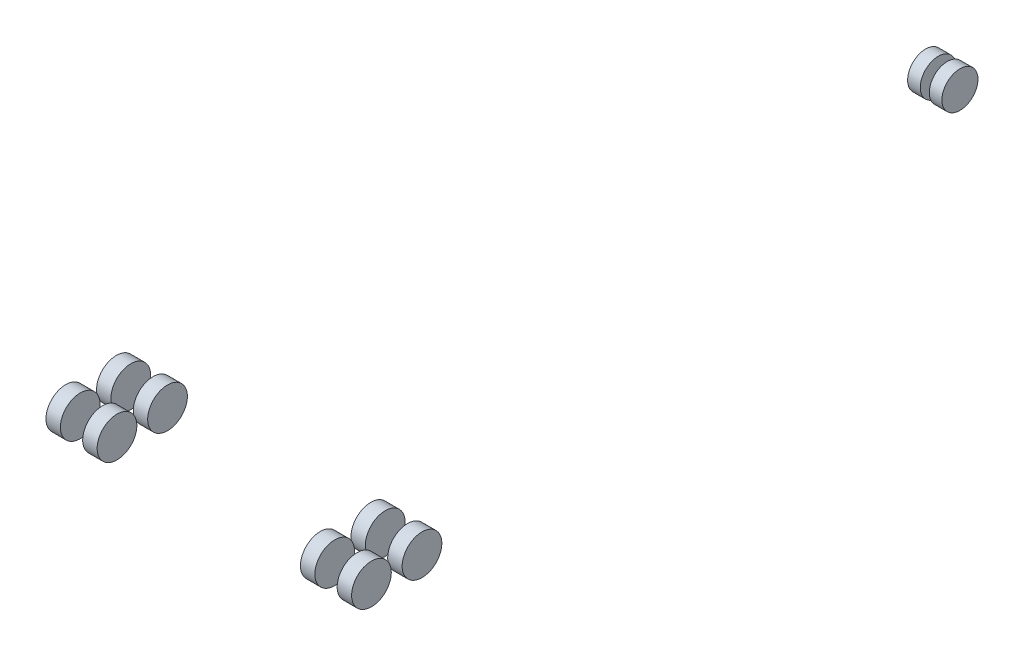
from build123d import *

# Parameters (mm, degrees)
MAIN_TIRE_1_DEPTH        = 203.2
MAIN_TIRE_1_DEPTH_BACK   = 203.2
SKETCH9_R                = 558.8
MAIN_TIRE_1_2_DEPTH      = 203.2
MAIN_TIRE_1_2_DEPTH_BACK = 203.2
MAIN_TIRE_2_DEPTH        = 203.2
MAIN_TIRE_2_DEPTH_BACK   = 203.2
SKETCH10_R               = 558.8
MAIN_TIRE_2_2_DEPTH      = 203.2
MAIN_TIRE_2_2_DEPTH_BACK = 203.2
MAIN_TIRE_3_DEPTH        = 203.2
MAIN_TIRE_3_DEPTH_BACK   = 203.2
SKETCH12_R               = 558.8
MAIN_TIRE_3_2_DEPTH      = 203.2
MAIN_TIRE_3_2_DEPTH_BACK = 203.2
MAIN_TIRE_4_DEPTH        = 203.2
MAIN_TIRE_4_DEPTH_BACK   = 203.2
SKETCH13_R               = 558.8
MAIN_TIRE_4_2_DEPTH      = 203.2
MAIN_TIRE_4_2_DEPTH_BACK = 203.2
NOSE_TIRE_1_DEPTH        = 177.8
NOSE_TIRE_1_DEPTH_BACK   = 177.8
SKETCH14_R               = 508
NOSE_TIRE_2_DEPTH        = 177.8
NOSE_TIRE_2_DEPTH_BACK   = 177.8
SKETCH15_R               = 508


with BuildPart() as part:
    # Sketch9 → Main tire 1 (new, two sides: drawn at the far end of the back side and taken through both)
    with BuildSketch(Plane(origin=(-3063.888900242, 0, 0), x_dir=(0, 0, -1), z_dir=(1, 0, 0)).offset(-MAIN_TIRE_1_DEPTH_BACK)):
        with Locations((-2701.028038879, 558.8)):
            Circle(SKETCH9_R)
    extrude(amount=MAIN_TIRE_1_DEPTH + MAIN_TIRE_1_DEPTH_BACK)


with BuildPart() as body_2:
    # Sketch9 → Main tire 1 2 (new, two sides: drawn at the far end of the back side and taken through both)
    with BuildSketch(Plane(origin=(-3063.888900242, 0, 0), x_dir=(0, 0, -1), z_dir=(1, 0, 0)).offset(-MAIN_TIRE_1_2_DEPTH_BACK)):
        with Locations((-1278.628038879, 558.8)):
            Circle(SKETCH9_R)
    extrude(amount=MAIN_TIRE_1_2_DEPTH + MAIN_TIRE_1_2_DEPTH_BACK)


with BuildPart() as body_3:
    # Sketch10 → Main tire 2 (new, two sides: drawn at the far end of the back side and taken through both)
    with BuildSketch(Plane(origin=(-4097.322992077, 0, 0), x_dir=(0, 0, -1), z_dir=(1, 0, 0)).offset(-MAIN_TIRE_2_DEPTH_BACK)):
        with Locations((-2701.028038879, 558.8)):
            Circle(SKETCH10_R)
    extrude(amount=MAIN_TIRE_2_DEPTH + MAIN_TIRE_2_DEPTH_BACK)


with BuildPart() as body_4:
    # Sketch10 → Main tire 2 2 (new, two sides: drawn at the far end of the back side and taken through both)
    with BuildSketch(Plane(origin=(-4097.322992077, 0, 0), x_dir=(0, 0, -1), z_dir=(1, 0, 0)).offset(-MAIN_TIRE_2_2_DEPTH_BACK)):
        with Locations((-1278.628038879, 558.8)):
            Circle(SKETCH10_R)
    extrude(amount=MAIN_TIRE_2_2_DEPTH + MAIN_TIRE_2_2_DEPTH_BACK)


with BuildPart() as body_5:
    # Sketch12 → Main tire 3 (new, two sides: drawn at the far end of the back side and taken through both)
    with BuildSketch(Plane(origin=(3063.888900242, 0, 0), x_dir=(0, 0, -1), z_dir=(1, 0, 0)).offset(-MAIN_TIRE_3_DEPTH_BACK)):
        with Locations((-1278.628038879, 558.8)):
            Circle(SKETCH12_R)
    extrude(amount=MAIN_TIRE_3_DEPTH + MAIN_TIRE_3_DEPTH_BACK)


with BuildPart() as body_6:
    # Sketch12 → Main tire 3 2 (new, two sides: drawn at the far end of the back side and taken through both)
    with BuildSketch(Plane(origin=(3063.888900242, 0, 0), x_dir=(0, 0, -1), z_dir=(1, 0, 0)).offset(-MAIN_TIRE_3_2_DEPTH_BACK)):
        with Locations((-2701.028038879, 558.8)):
            Circle(SKETCH12_R)
    extrude(amount=MAIN_TIRE_3_2_DEPTH + MAIN_TIRE_3_2_DEPTH_BACK)


with BuildPart() as body_7:
    # Sketch13 → Main tire 4 (new, two sides: drawn at the far end of the back side and taken through both)
    with BuildSketch(Plane(origin=(4097.322992077, 0, 0), x_dir=(0, 0, -1), z_dir=(1, 0, 0)).offset(-MAIN_TIRE_4_DEPTH_BACK)):
        with Locations((-2701.028038879, 558.8)):
            Circle(SKETCH13_R)
    extrude(amount=MAIN_TIRE_4_DEPTH + MAIN_TIRE_4_DEPTH_BACK)


with BuildPart() as body_8:
    # Sketch13 → Main tire 4 2 (new, two sides: drawn at the far end of the back side and taken through both)
    with BuildSketch(Plane(origin=(4097.322992077, 0, 0), x_dir=(0, 0, -1), z_dir=(1, 0, 0)).offset(-MAIN_TIRE_4_2_DEPTH_BACK)):
        with Locations((-1278.628038879, 558.8)):
            Circle(SKETCH13_R)
    extrude(amount=MAIN_TIRE_4_2_DEPTH + MAIN_TIRE_4_2_DEPTH_BACK)


with BuildPart() as body_9:
    # Sketch14 → Nose tire 1 (new, two sides: drawn at the far end of the back side and taken through both)
    with BuildSketch(Plane(origin=(-304.8, 0, 0), x_dir=(0, 0, -1), z_dir=(1, 0, 0)).offset(-NOSE_TIRE_1_DEPTH_BACK)):
        with Locations((17678.4, 508)):
            Circle(SKETCH14_R)
    extrude(amount=NOSE_TIRE_1_DEPTH + NOSE_TIRE_1_DEPTH_BACK)


with BuildPart() as body_10:
    # Sketch15 → Nose tire 2 (new, two sides: drawn at the far end of the back side and taken through both)
    with BuildSketch(Plane(origin=(304.8, 0, 0), x_dir=(0, 0, -1), z_dir=(1, 0, 0)).offset(-NOSE_TIRE_2_DEPTH_BACK)):
        with Locations((17678.4, 508)):
            Circle(SKETCH15_R)
    extrude(amount=NOSE_TIRE_2_DEPTH + NOSE_TIRE_2_DEPTH_BACK)


solid = Compound([part.part, body_2.part, body_3.part, body_4.part, body_5.part, body_6.part, body_7.part, body_8.part, body_9.part, body_10.part])
